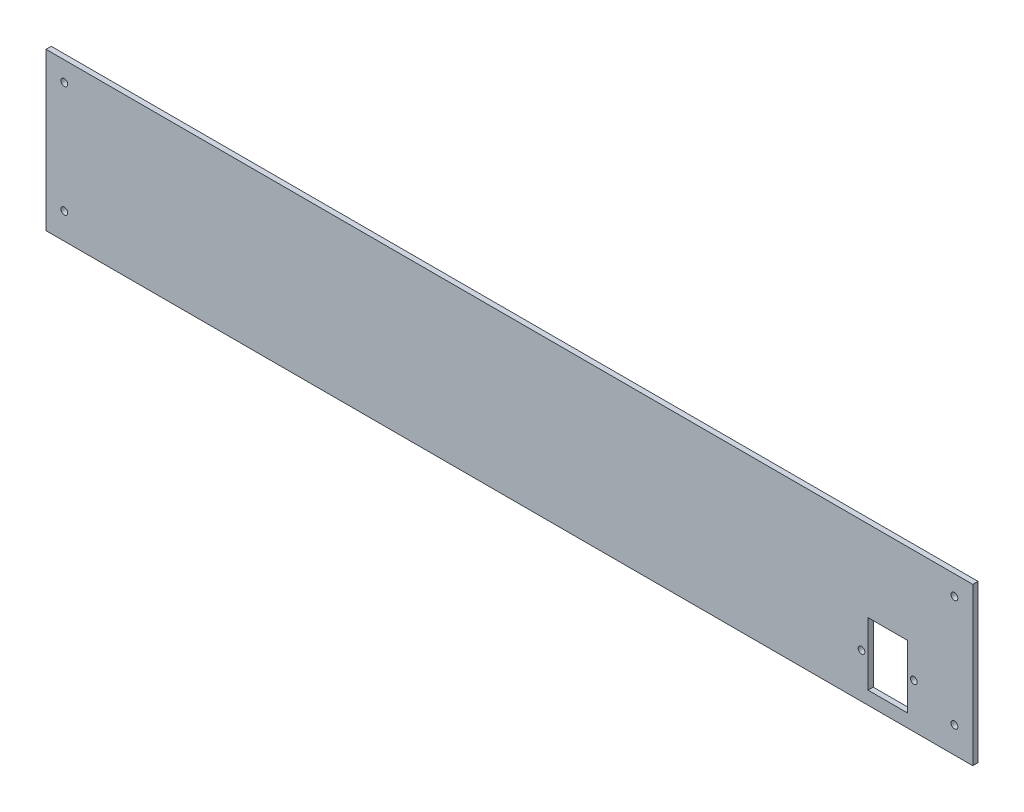
from build123d import *

# Parameters (mm, degrees)
SKETCH1_W           = 708
SKETCH1_H           = 120
BOSS_EXTRUDE1_DEPTH = 4
CUT_EXTRUDE1_REACH  = 720.109
SKETCH2_R           = 2.55
SKETCH2_W           = 30
SKETCH2_H           = 48
SKETCH5_R           = 2.6
CUT_EXTRUDE3_DEPTH  = 10
SKETCH6_R           = 2.6
CUT_EXTRUDE4_DEPTH  = 10


with BuildPart() as part:
    # Sketch1 → Boss-Extrude1 (new body)
    with BuildSketch(Plane.XY):
        with Locations((354, 60)):
            Rectangle(SKETCH1_W, SKETCH1_H)
    extrude(amount=BOSS_EXTRUDE1_DEPTH)

    # Sketch2 → Cut-Extrude1 (cut, up to next)
    with BuildSketch(Plane.XY.offset(4), mode=Mode.PRIVATE) as cut_extrude1_sk1:
        with Locations((623, 34)):
            Circle(SKETCH2_R)
    cut_extrude1_tool1 = extrude(cut_extrude1_sk1.sketch, amount=-CUT_EXTRUDE1_REACH, mode=Mode.PRIVATE) & part.part
    # Sketch2 → Cut-Extrude1 (cut, up to next)
    with BuildSketch(Plane.XY.offset(4), mode=Mode.PRIVATE) as cut_extrude1_sk2:
        with Locations((663, 34)):
            Circle(SKETCH2_R)
    cut_extrude1_tool2 = extrude(cut_extrude1_sk2.sketch, amount=-CUT_EXTRUDE1_REACH, mode=Mode.PRIVATE) & part.part
    # Sketch2 → Cut-Extrude1 (cut, up to next)
    with BuildSketch(Plane.XY.offset(4), mode=Mode.PRIVATE) as cut_extrude1_sk3:
        with Locations((643, 34)):
            Rectangle(SKETCH2_W, SKETCH2_H)
    cut_extrude1_tool3 = extrude(cut_extrude1_sk3.sketch, amount=-CUT_EXTRUDE1_REACH, mode=Mode.PRIVATE) & part.part
    add(cut_extrude1_tool1.solids().sort_by_distance((623, 34, 4))[0], mode=Mode.SUBTRACT)
    add(cut_extrude1_tool2.solids().sort_by_distance((663, 34, 4))[0], mode=Mode.SUBTRACT)
    add(cut_extrude1_tool3.solids().sort_by_distance((643, 34, 4))[0], mode=Mode.SUBTRACT)

    # Sketch5 → Cut-Extrude3 (cut)
    with BuildSketch(Plane(origin=(0, 0, 0), x_dir=(-1, 0, 0), z_dir=(0, 0, -1))):
        with Locations((-694, 105)):
            Circle(SKETCH5_R)
        with Locations((-14, 105)):
            Circle(SKETCH5_R)
    extrude(amount=-CUT_EXTRUDE3_DEPTH, mode=Mode.SUBTRACT)

    # Sketch6 → Cut-Extrude4 (cut)
    with BuildSketch(Plane(origin=(0, 0, 0), x_dir=(-1, 0, 0), z_dir=(0, 0, -1))):
        with Locations((-694, 20)):
            Circle(SKETCH6_R)
    cut_extrude4 = extrude(amount=-CUT_EXTRUDE4_DEPTH, mode=Mode.SUBTRACT)

    # Mirror7: Cut-Extrude4 across plane
    add(cut_extrude4.mirror(Plane(origin=(354, 0, 0), x_dir=(0, 0, 1), z_dir=(1, 0, 0))), mode=Mode.SUBTRACT)


solid = part.part
